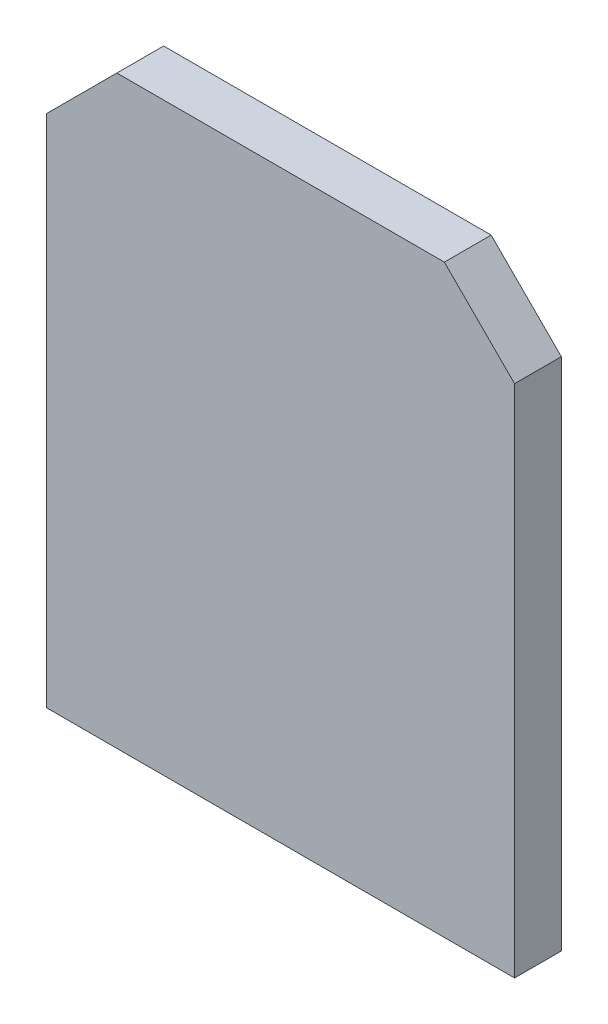
from build123d import *

# Parameters (mm, degrees)
BOSS_EXTRUDE1_DEPTH = 5.08


with BuildPart() as part:
    # Sketch1 → Boss-Extrude1 (new body)
    with BuildSketch(Plane.XY):
        Polygon((-25.4, 24.13), (-17.78, 31.75), (17.78, 31.75), (25.4, 24.13), (25.4, -31.75), (-25.4, -31.75), align=None)
    extrude(amount=BOSS_EXTRUDE1_DEPTH)


solid = part.part
